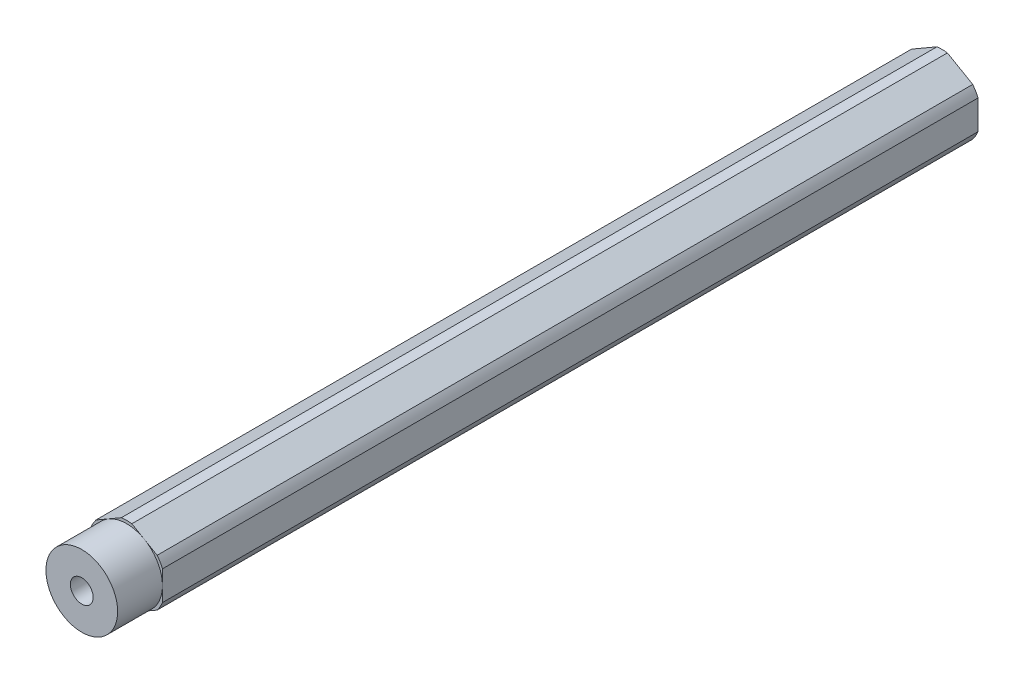
from build123d import *

# Parameters (mm, degrees)
BOSS_EXTRUDE1_DEPTH    = 72.23125
SKETCH2_R              = 6.35
SKETCH2_R_2            = 2.0193
BOSS_EXTRUDE2_DEPTH    = 7.9375
F_10_32_TAPPED_HOLE1_D = 4.0386


with BuildPart() as part:
    # Sketch1 → Boss-Extrude1 (new, symmetric)
    with BuildSketch(Plane.XY):
        with BuildLine():
            ThreePointArc((0.93173274, 6.79441227), (0, 6.858), (-0.93173274, 6.79441227))
            Line((-0.93173274, 6.79441227), (-5.41826726, 4.204110358))
            ThreePointArc((-5.41826726, 4.204110358), (-5.939202219, 3.429), (-6.35, 2.590301913))
            Line((-6.35, 2.590301913), (-6.35, -2.590301913))
            ThreePointArc((-6.35, -2.590301913), (-5.939202219, -3.429), (-5.41826726, -4.204110358))
            Line((-5.41826726, -4.204110358), (-0.93173274, -6.79441227))
            ThreePointArc((-0.93173274, -6.79441227), (0, -6.858), (0.93173274, -6.79441227))
            Line((0.93173274, -6.79441227), (5.41826726, -4.204110358))
            ThreePointArc((5.41826726, -4.204110358), (5.939202219, -3.429), (6.35, -2.590301913))
            Line((6.35, -2.590301913), (6.35, 2.590301913))
            ThreePointArc((6.35, 2.590301913), (5.939202219, 3.429), (5.41826726, 4.204110358))
            Line((5.41826726, 4.204110358), (0.93173274, 6.79441227))
        make_face()
    extrude(amount=BOSS_EXTRUDE1_DEPTH, both=True)

    # Sketch2 → Boss-Extrude2 (add)
    with BuildSketch(Plane.XY.offset(72.23125)):
        Circle(SKETCH2_R)
        Circle(SKETCH2_R_2, mode=Mode.SUBTRACT)
    extrude(amount=BOSS_EXTRUDE2_DEPTH)

    # #10-32 Tapped Hole1 (through all)
    with Locations(Plane(origin=(0, 0, -72.23125), x_dir=(-1, 0, 0), z_dir=(0, 0, -1))):
        with Locations((0, 0)):
            Hole(F_10_32_TAPPED_HOLE1_D / 2)


solid = part.part
